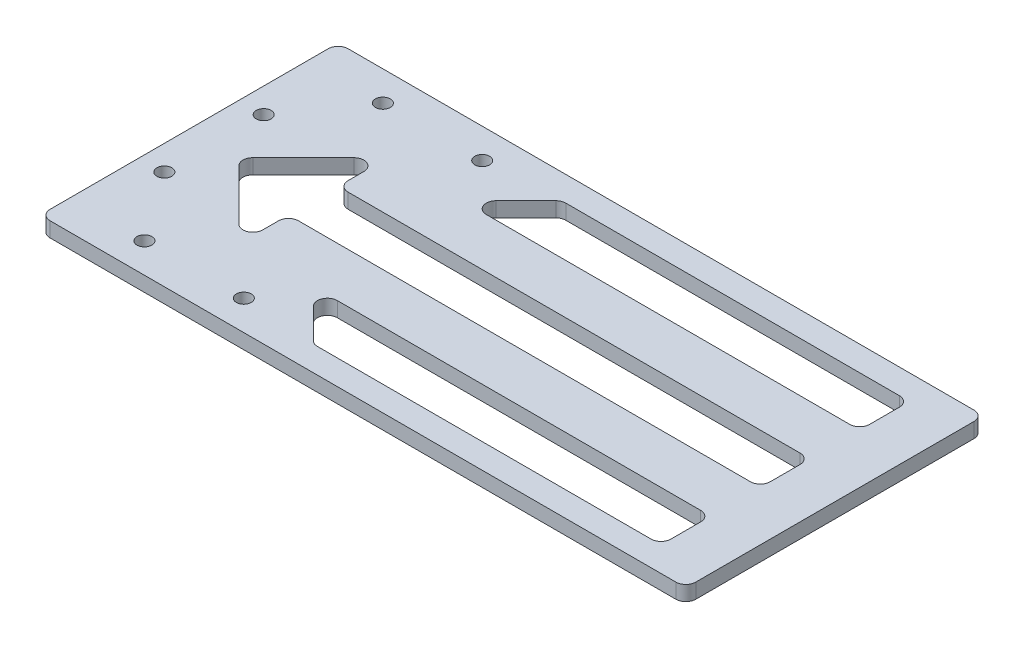
from build123d import *

# Parameters (mm, degrees)
SKETCH_1_W          = 130
SKETCH_1_H          = 60
SKETCH_1_R          = 1.5
EXTRUDE_1_DEPTH     = 3
SKETCH_2_R          = 1.5
CUT_EXTRUDE_1_DEPTH = 72.651936471
CUT_EXTRUDE_2_DEPTH = 72.651936471
FILLET_1_R          = 2


with BuildPart() as part:
    # 草图1 → 凸台-拉伸1 (new body)
    with BuildSketch(Plane(origin=(0, 0, 0), x_dir=(1, 0, 0), z_dir=(0, 1, 0))):
        Rectangle(SKETCH_1_W, SKETCH_1_H)
        with Locations(Location((-60, 10, 0), (0, 0, 270))):
            Circle(SKETCH_1_R, mode=Mode.SUBTRACT)
        with Locations(Location((-60, -10, 0), (0, 0, 270))):
            Circle(SKETCH_1_R, mode=Mode.SUBTRACT)
    extrude(amount=EXTRUDE_1_DEPTH)

    # 草图2 → 切除-拉伸1 (cut, through all)
    with BuildSketch(Plane(origin=(0, 3, 0), x_dir=(1, 0, 0), z_dir=(0, 1, 0))):
        with Locations(Location((-30, 24, 0), (0, 0, 270))):
            Circle(SKETCH_2_R)
        with Locations(Location((-50, 24, 0), (0, 0, 270))):
            Circle(SKETCH_2_R)
        with Locations(Location((-50, -24, 0), (0, 0, 90))):
            Circle(SKETCH_2_R)
        with Locations(Location((-30, -24, 0), (0, 0, 90))):
            Circle(SKETCH_2_R)
    extrude(amount=-CUT_EXTRUDE_1_DEPTH, mode=Mode.SUBTRACT)

    # 草图3 → 切除-拉伸2 (cut, through all)
    with BuildSketch(Plane(origin=(0, 3, 0), x_dir=(1, 0, 0), z_dir=(0, 1, 0))):
        Polygon((-55, 0), (-40, 15), (-40, 5), (55, 5), (55, -5), (-40, -5), (-40, -15), align=None)
        Polygon((-15, 25), (55, 25), (55, 15), (-25, 15), align=None)
        Polygon((55, -15), (-25, -15), (-15, -25), (55, -25), align=None)
    extrude(amount=-CUT_EXTRUDE_2_DEPTH, mode=Mode.SUBTRACT)

    # 圆角1
    fillet_1_edges = [part.edges().sort_by_distance(p)[0] for p in [
        (55, 1.5, 15),
        (55, 1.5, 25),
        (-15, 1.5, 25),
        (-25, 1.5, 15),
        (-25, 1.5, -15),
        (-15, 1.5, -25),
        (55, 1.5, -25),
        (55, 1.5, -15),
        (-40, 1.5, 15),
        (-55, 1.5, 0),
        (-40, 1.5, -15),
        (-40, 1.5, -5),
        (55, 1.5, -5),
        (55, 1.5, 5),
        (-40, 1.5, 5),
        (65, 1.5, 30),
        (-65, 1.5, 30),
        (-65, 1.5, -30),
        (65, 1.5, -30),
    ]]
    fillet(fillet_1_edges, radius=FILLET_1_R)


solid = part.part
